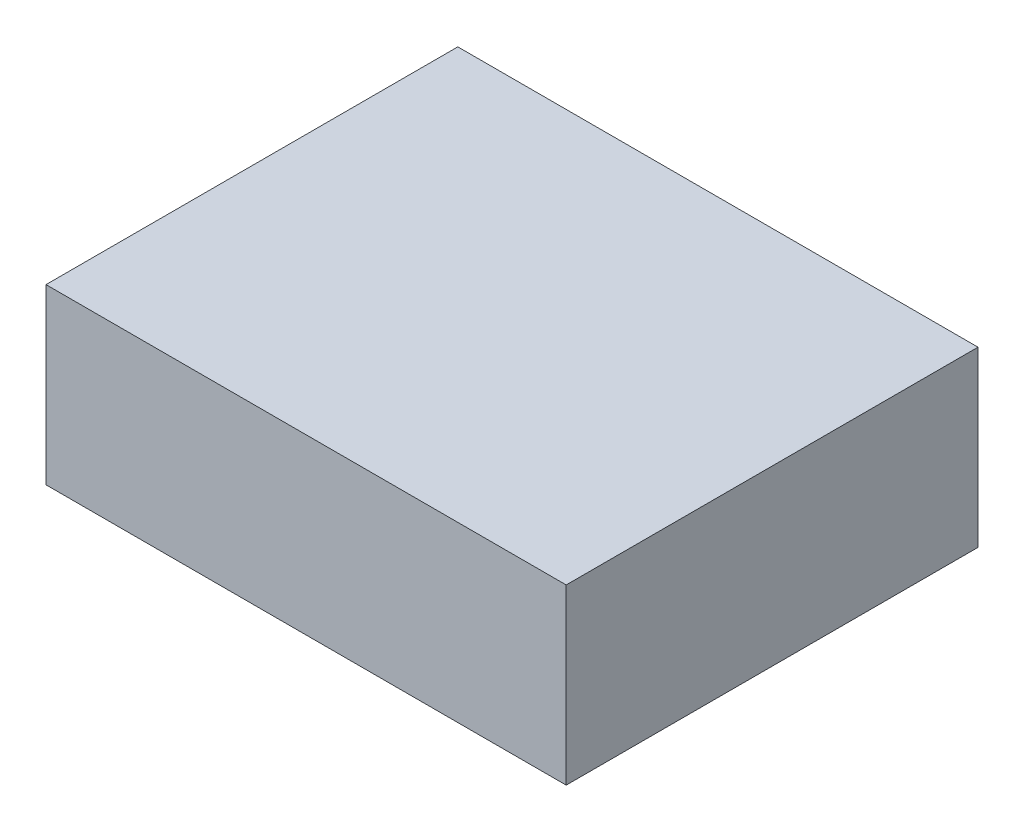
from build123d import *

# Parameters (mm, degrees)
SK_ENVELOPE_W     = 120
SK_ENVELOPE_H     = 95
EX_ENVELOPE_DEPTH = 40


with BuildPart() as part:
    # SK_Envelope → EX_Envelope (new body)
    with BuildSketch(Plane(origin=(0, 0, 0), x_dir=(1, 0, 0), z_dir=(0, 1, 0))):
        Rectangle(SK_ENVELOPE_W, SK_ENVELOPE_H)
    extrude(amount=EX_ENVELOPE_DEPTH)


solid = part.part
